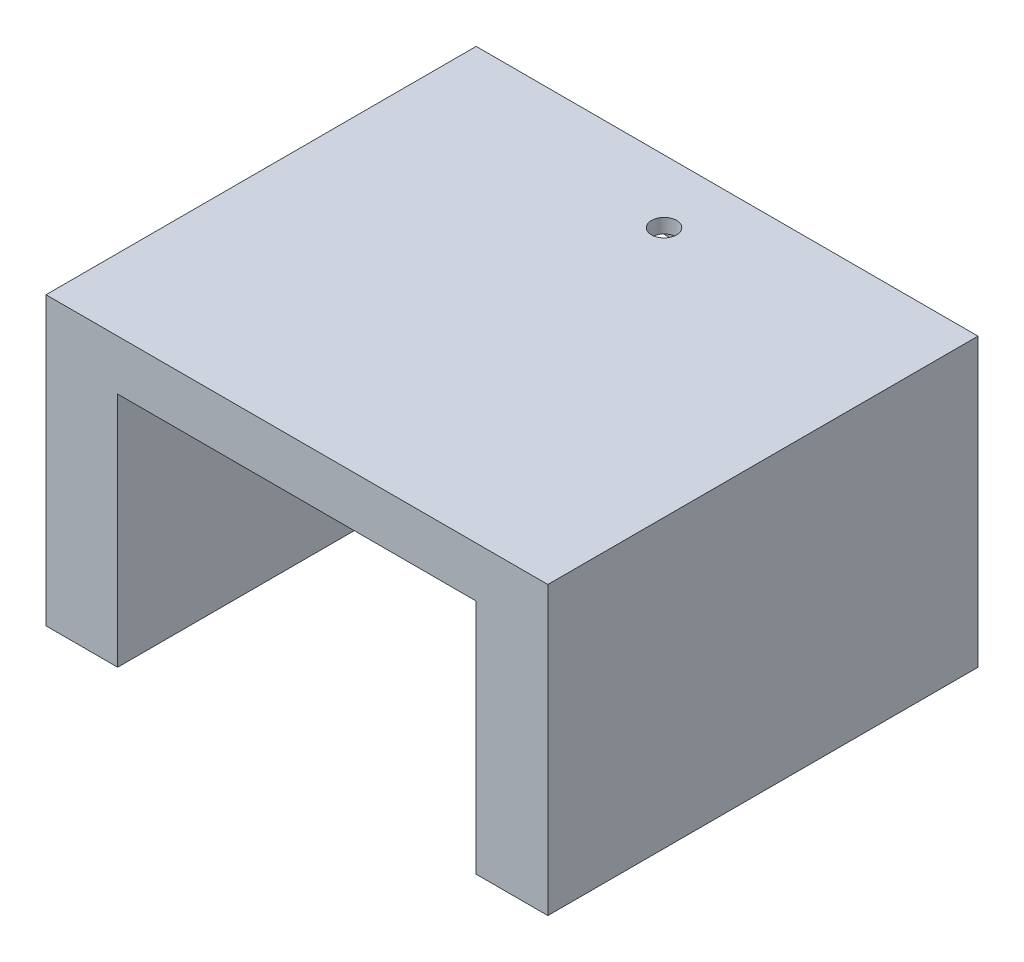
from build123d import *

# Parameters (mm, degrees)
BOSS_EXTRUDE1_DEPTH     = 60
CUT_EXTRUDE1_DEPTH      = 91.461766578
CUT_EXTRUDE1_DEPTH_BACK = 91.461766578
SKETCH2_R               = 1.75
SKETCH3_W               = 14.779269325
SKETCH3_H               = 12.394379378
CUT_EXTRUDE2_DEPTH      = 5


with BuildPart() as part:
    # Sketch1 → Boss-Extrude1 (new body)
    with BuildSketch(Plane.XY):
        Polygon((-59.112868416, -8.322842348), (-59.112868416, -48.322842348), (-49.112868416, -48.322842348), (-49.112868416, -15.322842348), (0.887131584, -15.322842348), (0.887131584, -48.322842348), (10.887131584, -48.322842348), (10.887131584, -8.322842348), align=None)
    extrude(amount=BOSS_EXTRUDE1_DEPTH)

    # Sketch2 → Cut-Extrude1 (cut, two sides: drawn at the far end of the back side and taken through both)
    with BuildSketch(Plane(origin=(0, -15.322842348, 0), x_dir=(1, 0, 0), z_dir=(0, 1, 0)).offset(-CUT_EXTRUDE1_DEPTH_BACK)):
        with Locations(Location((-24.112868416, -8.79280196, 0), (0, 0, 270))):
            Circle(SKETCH2_R)
    extrude(amount=CUT_EXTRUDE1_DEPTH + CUT_EXTRUDE1_DEPTH_BACK, mode=Mode.SUBTRACT)

    # Sketch3 → Cut-Extrude2 (cut)
    with BuildSketch(Plane(origin=(0, -15.322842348, 0), x_dir=(-1, 0, 0), z_dir=(0, -1, 0))):
        with Locations((24.112868416, -8.79280196)):
            Rectangle(SKETCH3_W, SKETCH3_H)
    extrude(amount=-CUT_EXTRUDE2_DEPTH, mode=Mode.SUBTRACT)


solid = part.part
